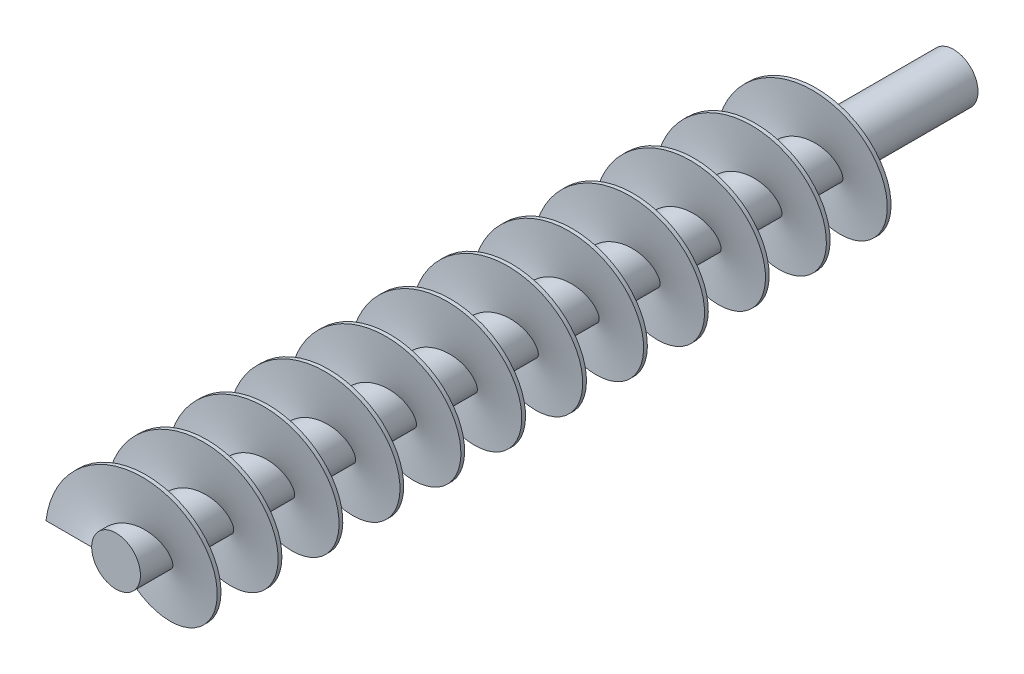
from build123d import *

# Parameters (mm, degrees)
SKETCH1_R           = 3.2
BOSS_EXTRUDE2_DEPTH = 110
SWEEP1_PITCH        = 8
SWEEP1_HEIGHT       = 8
SWEEP1_RADIUS       = 3.2
SKETCH3_W           = 6
SKETCH3_H           = 0.5
LPATTERN1_COUNT     = 12
LPATTERN1_PITCH     = 8


with BuildPart() as part:
    # Sketch1 → Boss-Extrude2 (new body)
    with BuildSketch(Plane.XY):
        Circle(SKETCH1_R)
    extrude(amount=BOSS_EXTRUDE2_DEPTH)


with BuildPart() as body_2:
    # Sweep1: sweep along a helix
    with BuildLine() as sweep1_path:
        Helix(SWEEP1_PITCH, SWEEP1_HEIGHT, SWEEP1_RADIUS, center=(0, 0, 110), direction=(0, 0, -1))
    # Sketch3 → Sweep1 (sweep)
    with BuildSketch(Plane(origin=(-3.2, 0, 110), x_dir=(1, 0, 0), z_dir=(-6.771371120558259e-15, 0.9291520335781362, -0.36969784756962565))):
        with Locations((-3, 0.25)):
            Rectangle(SKETCH3_W, SKETCH3_H)
    sweep(path=sweep1_path.line, is_frenet=True)


with BuildPart() as lpattern1_1:
    # LPattern1: pattern copy
    add(body_2.part.moved(Location(Vector(0, 0, -1) * (1 * LPATTERN1_PITCH))))


with BuildPart() as lpattern1_2:
    # LPattern1: pattern copy
    add(body_2.part.moved(Location(Vector(0, 0, -1) * (2 * LPATTERN1_PITCH))))


with BuildPart() as lpattern1_3:
    # LPattern1: pattern copy
    add(body_2.part.moved(Location(Vector(0, 0, -1) * (3 * LPATTERN1_PITCH))))


with BuildPart() as lpattern1_4:
    # LPattern1: pattern copy
    add(body_2.part.moved(Location(Vector(0, 0, -1) * (4 * LPATTERN1_PITCH))))


with BuildPart() as lpattern1_5:
    # LPattern1: pattern copy
    add(body_2.part.moved(Location(Vector(0, 0, -1) * (5 * LPATTERN1_PITCH))))


with BuildPart() as lpattern1_6:
    # LPattern1: pattern copy
    add(body_2.part.moved(Location(Vector(0, 0, -1) * (6 * LPATTERN1_PITCH))))


with BuildPart() as lpattern1_7:
    # LPattern1: pattern copy
    add(body_2.part.moved(Location(Vector(0, 0, -1) * (7 * LPATTERN1_PITCH))))


with BuildPart() as lpattern1_8:
    # LPattern1: pattern copy
    add(body_2.part.moved(Location(Vector(0, 0, -1) * (8 * LPATTERN1_PITCH))))


with BuildPart() as lpattern1_9:
    # LPattern1: pattern copy
    add(body_2.part.moved(Location(Vector(0, 0, -1) * (9 * LPATTERN1_PITCH))))


with BuildPart() as lpattern1_10:
    # LPattern1: pattern copy
    add(body_2.part.moved(Location(Vector(0, 0, -1) * (10 * LPATTERN1_PITCH))))


with BuildPart() as lpattern1_11:
    # LPattern1: pattern copy
    add(body_2.part.moved(Location(Vector(0, 0, -1) * (11 * LPATTERN1_PITCH))))


solid = Compound([part.part, body_2.part, lpattern1_1.part, lpattern1_2.part, lpattern1_3.part, lpattern1_4.part, lpattern1_5.part, lpattern1_6.part, lpattern1_7.part, lpattern1_8.part, lpattern1_9.part, lpattern1_10.part, lpattern1_11.part])
